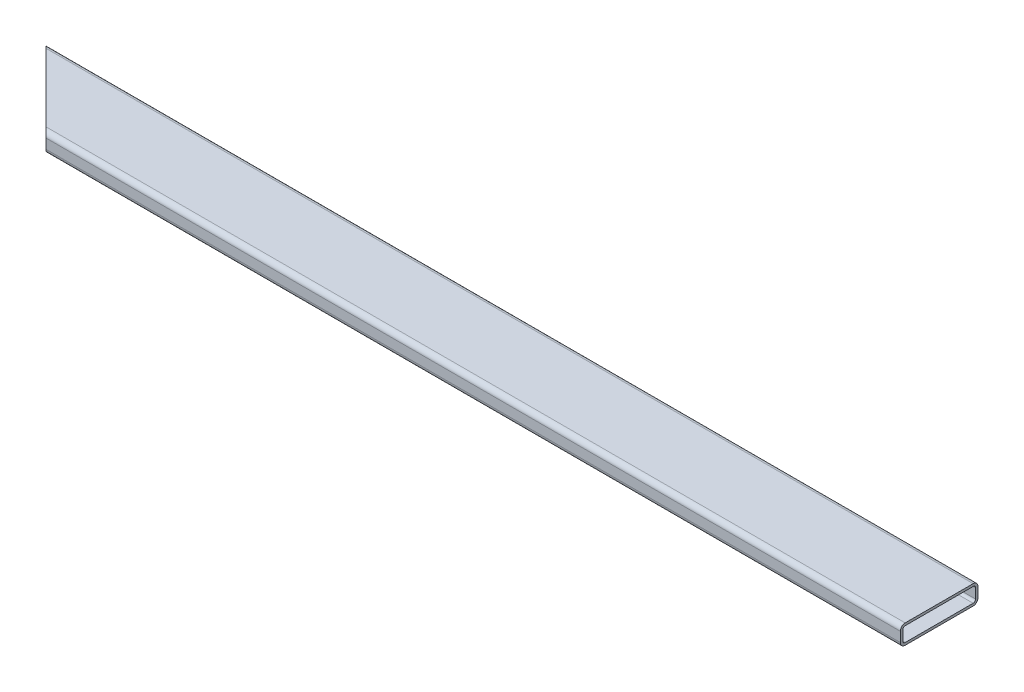
from build123d import *

# Parameters (mm, degrees)
SKETCH1_W           = 101.6
SKETCH1_H           = 25.4
BOSS_EXTRUDE1_DEPTH = 1219.2
FILLET1_R           = 6.35
SHELL1_T            = -3.175
CUT_EXTRUDE1_DEPTH  = 25.4


with BuildPart() as part:
    # Sketch1 → Boss-Extrude1 (new body)
    with BuildSketch(Plane(origin=(0, 0, 0), x_dir=(0, 0, -1), z_dir=(1, 0, 0))):
        with Locations((50.8, 12.7)):
            Rectangle(SKETCH1_W, SKETCH1_H)
    extrude(amount=BOSS_EXTRUDE1_DEPTH)

    # Fillet1
    fillet1_edges = [part.edges().sort_by_distance(p)[0] for p in [
        (609.6, 25.4, 0),
        (609.6, 25.4, -101.6),
        (609.6, 0, -101.6),
        (609.6, 0, 0),
    ]]
    fillet(fillet1_edges, radius=FILLET1_R)

    # Shell1
    shell1_openings = [part.faces().sort_by_distance(p)[0] for p in [
        (1219.2, 12.7, -50.8),
        (0, 12.7, -50.8),
    ]]
    offset(amount=SHELL1_T, openings=shell1_openings, kind=Kind.INTERSECTION)

    # Sketch2 → Cut-Extrude1 (cut)
    with BuildSketch(Plane(origin=(0, 25.4, 0), x_dir=(1, 0, 0), z_dir=(0, 1, 0))):
        Polygon((0, 101.6), (101.6, 0), (0, 0), align=None)
    extrude(amount=-CUT_EXTRUDE1_DEPTH, mode=Mode.SUBTRACT)


solid = part.part
